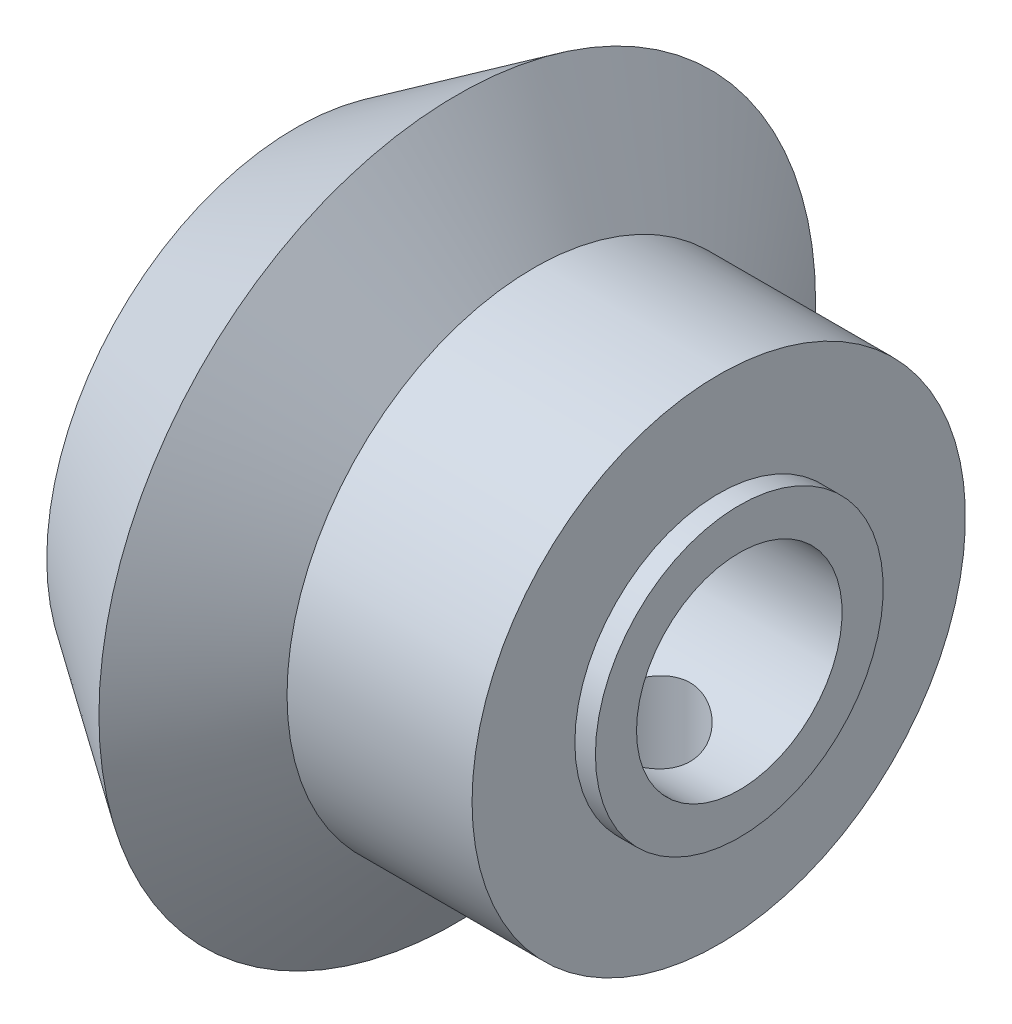
from build123d import *

# Parameters (mm, degrees)
TAP_DRILL_FOR_M3X0_5_TAP1_REACH  = 21.005
TAP_DRILL_FOR_M3X0_5_TAP1_BORE_R = 1.3


with BuildPart() as part:
    # Sketch1 → Revolve1 (revolve)
    with BuildSketch(Plane(origin=(0, 0, 0), x_dir=(-1, 0, 0), z_dir=(0, 0, -1)), mode=Mode.PRIVATE) as revolve1_sk:
        Polygon((-22.5, 3.5), (-22.5, 2.5), (-12.5, 2.5), (-12.5, 4.9), (-11.71, 6.053145161), (-15.64, 8.715), (-17.5, 6), (-22, 6), (-22, 3.5), align=None)
    revolve(revolve1_sk.sketch.rotate(Axis((22.5, 0, 0), (-1, 0, 0)), 270), axis=Axis((22.5, 0, 0), (-1, 0, 0)))

    # Tap Drill for M3x0.5 Tap1 bore (on position points) → Tap Drill for M3x0.5 Tap1 (cut, up to next)
    with BuildSketch(Plane(origin=(20, -6, 0), x_dir=(0, 0, -1), z_dir=(0, -1, 0)), mode=Mode.PRIVATE) as tap_drill_for_m3x0_5_tap1_sk1:
        Circle(TAP_DRILL_FOR_M3X0_5_TAP1_BORE_R)
    tap_drill_for_m3x0_5_tap1_tool1 = extrude(tap_drill_for_m3x0_5_tap1_sk1.sketch, amount=-TAP_DRILL_FOR_M3X0_5_TAP1_REACH, mode=Mode.PRIVATE) & part.part
    add(tap_drill_for_m3x0_5_tap1_tool1.solids().sort_by_distance((20, -6, 0))[0], mode=Mode.SUBTRACT)


solid = part.part
